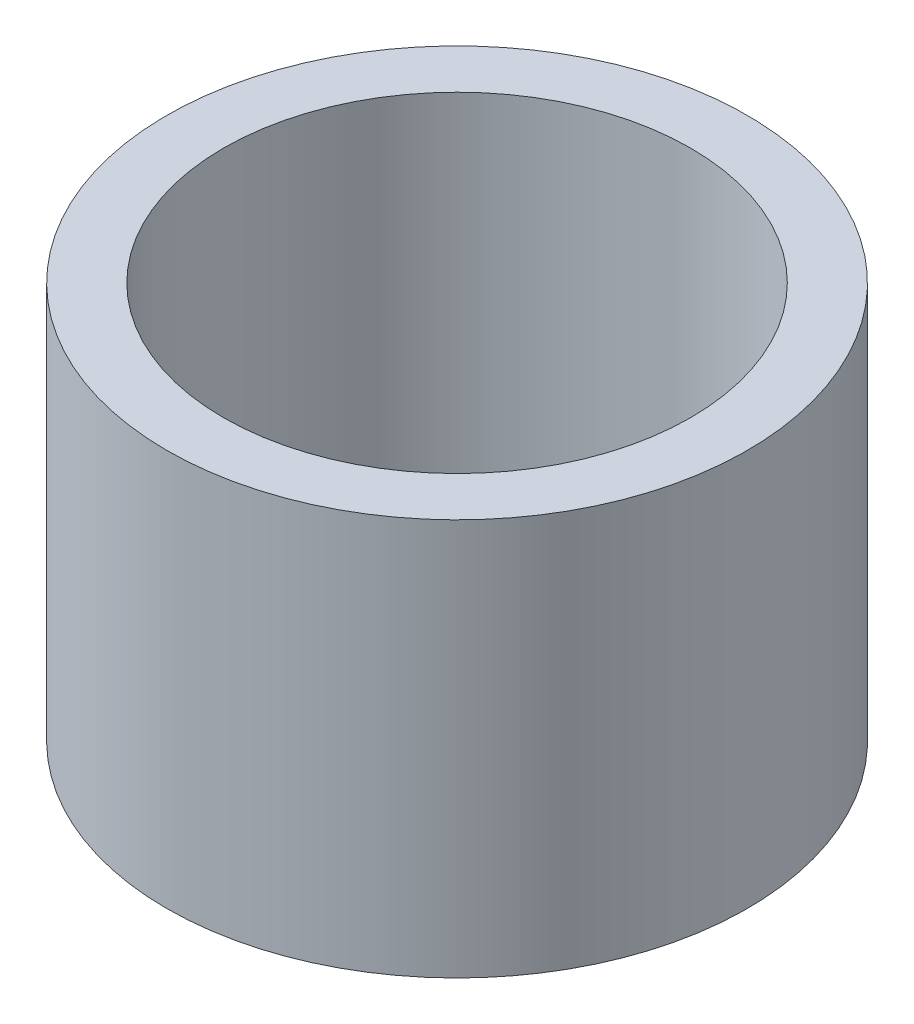
from build123d import *

# Parameters (mm, degrees)
SKETCH1_R           = 32.512
BOSS_EXTRUDE2_DEPTH = 44.45
SKETCH10_R          = 26.162
CUT_EXTRUDE1_DEPTH  = 44.45


with BuildPart() as part:
    # Sketch1 → Boss-Extrude2 (new body)
    with BuildSketch(Plane(origin=(27.278832786, 0, -45.593175478), x_dir=(1, 0, 0), z_dir=(0, 1, 0))):
        with Locations(Location((-15.68588275, 3.798924729, 0), (0, 0, 270))):
            Circle(SKETCH1_R)
    extrude(amount=BOSS_EXTRUDE2_DEPTH)

    # Sketch10 → Cut-Extrude1 (cut)
    with BuildSketch(Plane(origin=(0, 44.45, 0), x_dir=(1, 0, 0), z_dir=(0, 1, 0))):
        with Locations(Location((11.592950035, 49.392100207, 0), (0, 0, 270))):
            Circle(SKETCH10_R)
    extrude(amount=-CUT_EXTRUDE1_DEPTH, mode=Mode.SUBTRACT)


solid = part.part
